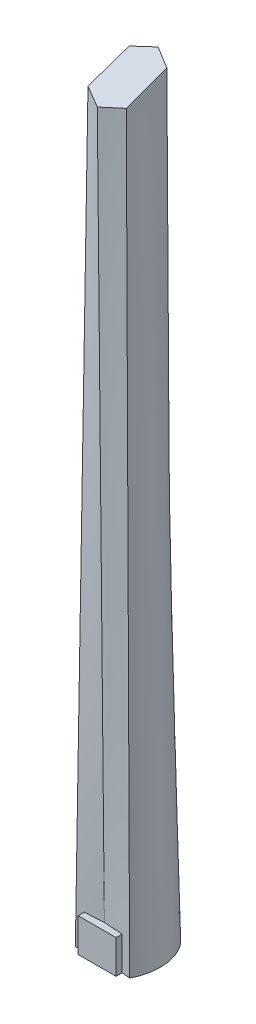
from build123d import *

# Parameters (mm, degrees)
BOSS_EXTRUDE3_DEPTH = 3.5
CUT_EXTRUDE1_DEPTH  = 5


with BuildPart() as part:
    # Sketch3 → Boss-Extrude3 (new, symmetric)
    with BuildSketch(Plane(origin=(0, 0, 0), x_dir=(0, 0, -1), z_dir=(1, 0, 0))):
        with BuildLine():
            Line((18.2, 3.1), (23.7, 3.1))
            ThreePointArc((23.7, 3.1), (26.8, 0), (23.7, -3.1))
            Line((23.7, -3.1), (18.2, -3.1))
            Line((18.2, -3.1), (18.2, 3.1))
        make_face()
    extrude(amount=BOSS_EXTRUDE3_DEPTH, both=True)

    # Sketch5 → Loft4 section 0
    with BuildSketch(Plane.XZ.offset(3.1)):
        with BuildLine():
            Line((5.011058699, -19.2), (0, -19.603876814))
            Line((0, -19.603876814), (-5.011058699, -19.2))
            add(Edge.make_bspline(
                [(-5.011058699, -19.2), (-11.211254093, -30.360468439), (-0.5, -31.474052325)],
                knots=[4.097432377, 4.097432377, 4.097432377, 6.201595221, 6.201595221, 6.201595221], degree=2, weights=[1, 0.495764497, 1]))
            Line((-0.5, -31.474052325), (0, -31.6))
            Line((0, -31.6), (0.5, -31.474052325))
            add(Edge.make_bspline(
                [(0.5, -31.474052325), (11.211254093, -30.360468439), (5.011058699, -19.2)],
                knots=[0.081590086, 0.081590086, 0.081590086, 2.185752931, 2.185752931, 2.185752931], degree=2, weights=[1, 0.495764497, 1]))
        make_face()
    # Sketch4 → Loft4 section 1
    with BuildSketch(Plane(origin=(0, 138.1, 0), x_dir=(1, 0, 0), z_dir=(0, 1, 0))):
        with BuildLine():
            Line((-3.5, 27.575), (-3.5, 20.075))
            Line((-3.5, 20.075), (0, 18.2))
            Line((0, 18.2), (3.5, 20.075))
            Line((3.5, 20.075), (3.5, 27.575))
            Line((3.5, 27.575), (0, 29.45))
            Line((0, 29.45), (-3.5, 27.575))
        make_face()
    loft()

    # Sketch6 → Cut-Extrude1 (cut, symmetric)
    with BuildSketch(Plane(origin=(0, 0, 0), x_dir=(0, 0, -1), z_dir=(1, 0, 0))):
        Polygon((29.45, 138.1), (18.239769881, 134.1), (18.2, 138.1), align=None)
    extrude(amount=CUT_EXTRUDE1_DEPTH, both=True, mode=Mode.SUBTRACT)


solid = part.part
